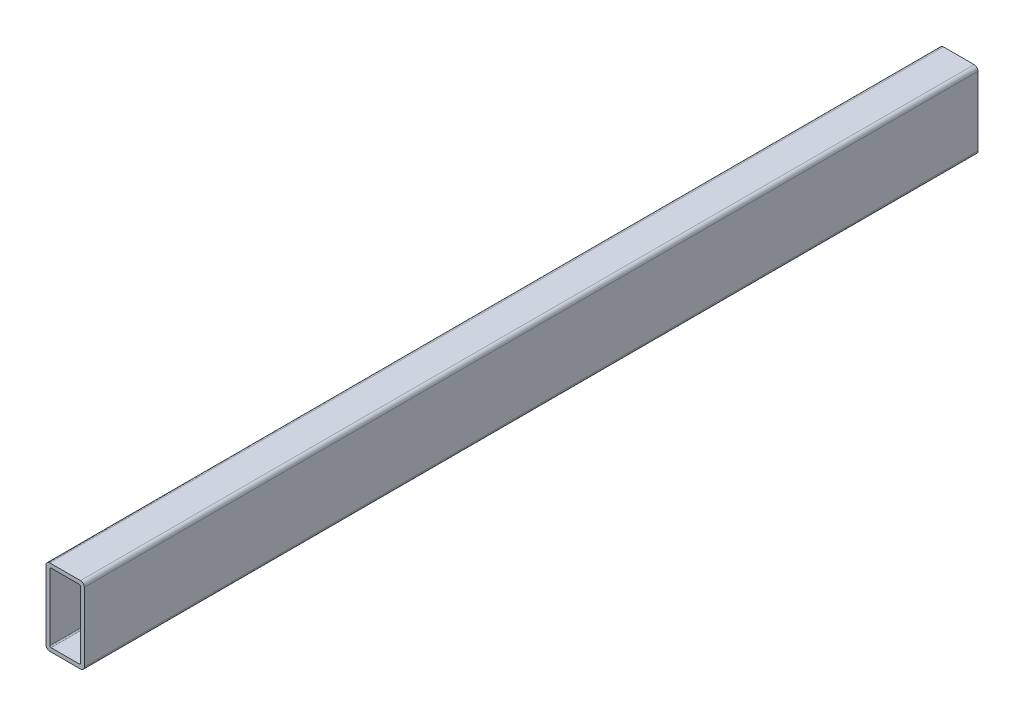
from build123d import *

# Parameters (mm, degrees)
DODANIE_WYCI_GNI_CIE1_DEPTH = 700


with BuildPart() as part:
    # Szkic1 → Dodanie-wyciągnięcie1 (new body)
    with BuildSketch(Plane.XY):
        with BuildLine():
            Line((-12, -60), (12, -60))
            ThreePointArc((12, -60), (14.121320344, -59.121320344), (15, -57))
            Line((15, -57), (15, -3))
            ThreePointArc((15, -3), (14.121320344, -0.878679656), (12, 0))
            Line((12, 0), (-12, 0))
            ThreePointArc((-12, 0), (-14.121320344, -0.878679656), (-15, -3))
            Line((-15, -3), (-15, -57))
            ThreePointArc((-15, -57), (-14.121320344, -59.121320344), (-12, -60))
        make_face()
        with BuildLine():
            Line((-11, -3), (11, -3))
            ThreePointArc((11, -3), (11.707106781, -3.292893219), (12, -4))
            Line((12, -4), (12, -56))
            ThreePointArc((12, -56), (11.707106781, -56.707106781), (11, -57))
            Line((11, -57), (-11, -57))
            ThreePointArc((-11, -57), (-11.707106781, -56.707106781), (-12, -56))
            Line((-12, -56), (-12, -4))
            ThreePointArc((-12, -4), (-11.707106781, -3.292893219), (-11, -3))
        make_face(mode=Mode.SUBTRACT)
    extrude(amount=-DODANIE_WYCI_GNI_CIE1_DEPTH)


solid = part.part
